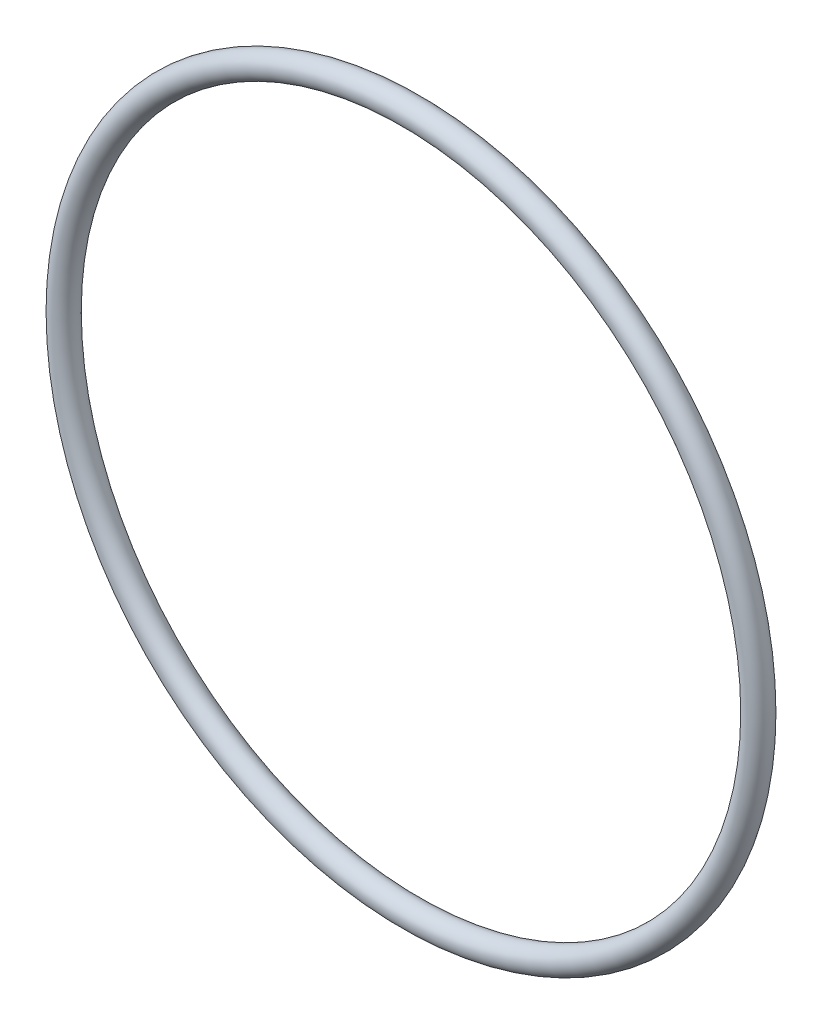
from build123d import *

# Parameters (mm, degrees)
SKETCH2_R = 1.7653


with BuildPart() as part:
    # Sketch2 → Revolve1 (revolve)
    with BuildSketch(Plane(origin=(0, 0, 0), x_dir=(1, 0, 0), z_dir=(0, 1, 0)), mode=Mode.PRIVATE) as revolve1_sk:
        with Locations((-49.1871, 0)):
            Circle(SKETCH2_R)
    revolve(revolve1_sk.sketch.rotate(Axis((0, 0, 1.7653), (0, 0, -1)), 180), axis=Axis((0, 0, 1.7653), (0, 0, -1)))


solid = part.part
